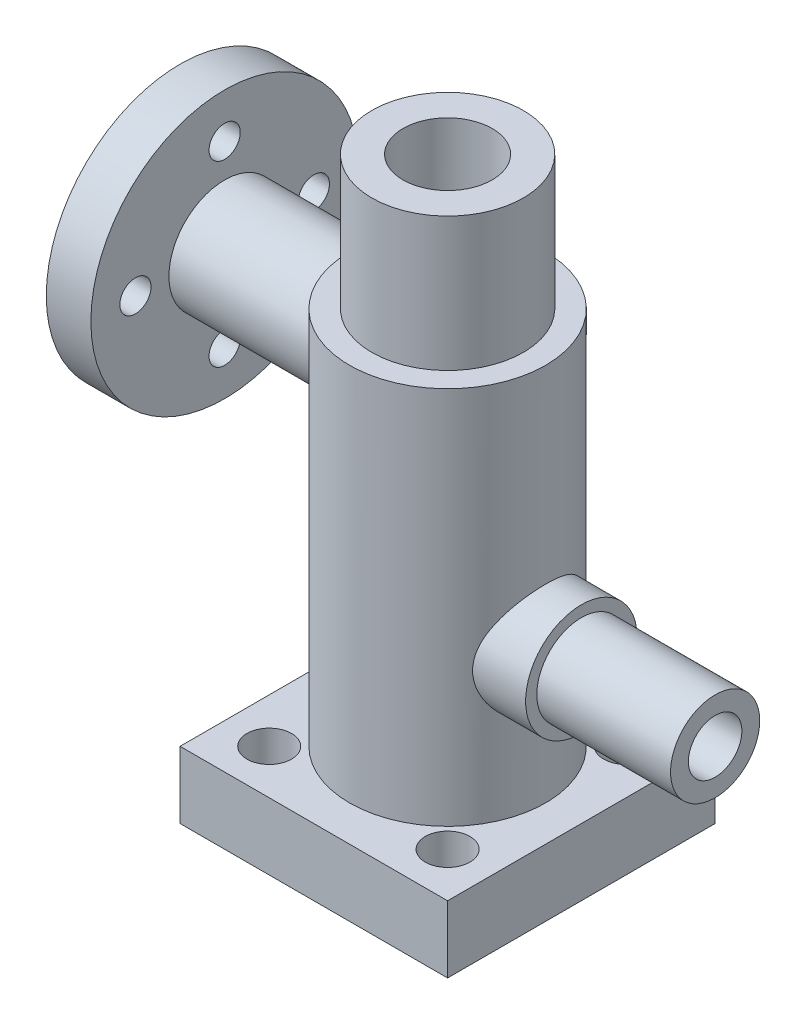
from build123d import *

# Parameters (mm, degrees)
SKETCH1_W                             = 60
SKETCH1_H                             = 60
BOSS_EXTRUDE1_DEPTH                   = 15
SKETCH2_R                             = 22
BOSS_EXTRUDE2_DEPTH                   = 85
SKETCH3_R                             = 17
BOSS_EXTRUDE3_DEPTH                   = 30
HOLE1_D                               = 20
HOLE1_DEPTH                           = 115
SKETCH9_R                             = 5
CUT_EXTRUDE1_DEPTH                    = 123.576506721
MIRROR2_COPY_1_SKETCH_R               = 5
MIRROR2_COPY_1_DEPTH                  = 123.576506721
BOSS_EXTRUDE4_REACH                   = 162.935
BOSS_EXTRUDE4_END_RADIUS              = 22
SKETCH10_R                            = 12.5
SKETCH11_R                            = 30
BOSS_EXTRUDE5_DEPTH                   = 10
HOLE2_REACH                           = 162.935
HOLE2_BORE_R                          = 10
TAP_DRILL_FOR_M8X1_0_TAP1_D           = 7
TAP_DRILL_FOR_M8X1_0_TAP1_DEPTH       = 10
TAP_DRILL_FOR_M8X1_0_TAP1_CSINK_D     = 7.05
TAP_DRILL_FOR_M8X1_0_TAP1_CSINK_ANGLE = 90
CIRPATTERN1_COUNT                     = 4
BOSS_EXTRUDE6_REACH                   = 211.444
BOSS_EXTRUDE6_END_RADIUS              = 22
BOSS_EXTRUDE6_START                   = -30
SKETCH18_R                            = 12.5
SKETCH20_R                            = 10
BOSS_EXTRUDE7_DEPTH                   = 30
HOLE3_REACH                           = 181.444
HOLE3_BORE_R                          = 6


with BuildPart() as part:
    # Sketch1 → Boss-Extrude1 (new body)
    with BuildSketch(Plane(origin=(0, 0, 0), x_dir=(1, 0, 0), z_dir=(0, 1, 0))):
        Rectangle(SKETCH1_W, SKETCH1_H)
    extrude(amount=BOSS_EXTRUDE1_DEPTH)

    # Sketch2 → Boss-Extrude2 (add)
    with BuildSketch(Plane(origin=(0, 15, 0), x_dir=(1, 0, 0), z_dir=(0, 1, 0))):
        with Locations(Location((0, 0, 0), (0, 0, 270))):
            Circle(SKETCH2_R)
    extrude(amount=BOSS_EXTRUDE2_DEPTH)

    # Sketch3 → Boss-Extrude3 (add)
    with BuildSketch(Plane(origin=(0, 100, 0), x_dir=(1, 0, 0), z_dir=(0, 1, 0))):
        with Locations(Location((0, 0, 0), (0, 0, 270))):
            Circle(SKETCH3_R)
    extrude(amount=BOSS_EXTRUDE3_DEPTH)

    # Hole1
    with Locations(Plane(origin=(0, 130, 0), x_dir=(1, 0, 0), z_dir=(0, 1, 0))):
        with Locations((0, 0)):
            Hole(HOLE1_D / 2, depth=HOLE1_DEPTH)

    # Sketch9 → Cut-Extrude1 (cut, through all)
    with BuildSketch(Plane(origin=(0, 15, 0), x_dir=(1, 0, 0), z_dir=(0, 1, 0))):
        with Locations(Location((20, 20, 0), (0, 0, 270))):
            Circle(SKETCH9_R)
    cut_extrude1 = extrude(amount=-CUT_EXTRUDE1_DEPTH, mode=Mode.SUBTRACT)

    # Mirror1: Cut-Extrude1 across plane
    add(cut_extrude1.mirror(Plane(origin=(0, 0, 0), x_dir=(0, 0, 1), z_dir=(1, 0, 0))), mode=Mode.SUBTRACT)

    # Mirror2: Cut-Extrude1 across plane
    add(cut_extrude1.mirror(Plane.XY), mode=Mode.SUBTRACT)

    # Mirror2 copy 1 sketch → Mirror2 copy 1 (cut, through all)
    with BuildSketch(Plane(origin=(0, 15, 0), x_dir=(-1, 0, 0), z_dir=(0, 1, 0))):
        with Locations(Location((20, 20, 0), (0, 0, 270))):
            Circle(MIRROR2_COPY_1_SKETCH_R)
    extrude(amount=-MIRROR2_COPY_1_DEPTH, mode=Mode.SUBTRACT)

    # Boss-Extrude4: up to this cylinder (the profile starts outside it)
    boss_extrude4_end = Plane(origin=(0, 87.5, 0), z_dir=(0, -1, 0)) * Cylinder(BOSS_EXTRUDE4_END_RADIUS, 370.87, mode=Mode.PRIVATE)
    # Sketch10 → Boss-Extrude4 (add, up to the surface)
    with BuildSketch(Plane(origin=(-60, 0, 0), x_dir=(0, 0, -1), z_dir=(1, 0, 0)), mode=Mode.PRIVATE) as boss_extrude4_sk1:
        with Locations(Location((0, 87.5, 0), (0, 0, 90))):
            Circle(SKETCH10_R)
    boss_extrude4_tool1 = extrude(boss_extrude4_sk1.sketch, amount=BOSS_EXTRUDE4_REACH, mode=Mode.PRIVATE) - boss_extrude4_end
    add(boss_extrude4_tool1.solids().sort_by_distance((-60, 87.5, 0))[0])

    # Sketch11 → Boss-Extrude5 (add)
    with BuildSketch(Plane.ZY.offset(60)):
        with Locations((0, 87.5)):
            Circle(SKETCH11_R)
    extrude(amount=-BOSS_EXTRUDE5_DEPTH)

    # Hole2 bore → Hole2 (cut, up to next)
    with BuildSketch(Plane.ZY.offset(60), mode=Mode.PRIVATE) as hole2_sk1:
        with Locations((0, 87.5)):
            Circle(HOLE2_BORE_R)
    hole2_tool1 = extrude(hole2_sk1.sketch, amount=-HOLE2_REACH, mode=Mode.PRIVATE) & part.part
    add(hole2_tool1.solids().sort_by_distance((-60, 87.5, 0))[0], mode=Mode.SUBTRACT)

    # Tap Drill for M8x1.0 Tap1
    with Locations(Plane.ZY.offset(60)):
        with Locations((20, 87.5)):
            tap_drill_for_m8x1_0_tap1 = CounterSinkHole(TAP_DRILL_FOR_M8X1_0_TAP1_D / 2, TAP_DRILL_FOR_M8X1_0_TAP1_CSINK_D / 2, depth=TAP_DRILL_FOR_M8X1_0_TAP1_DEPTH, counter_sink_angle=TAP_DRILL_FOR_M8X1_0_TAP1_CSINK_ANGLE)

    # CirPattern1: Tap Drill for M8x1.0 Tap1 ×4 about axis
    cirpattern1_axis = Axis((0, 87.5, 0), (1, 0, 0))
    for i in range(1, CIRPATTERN1_COUNT):
        add(tap_drill_for_m8x1_0_tap1.rotate(cirpattern1_axis, i * 360 / CIRPATTERN1_COUNT), mode=Mode.SUBTRACT)

    # Boss-Extrude6: up to this cylinder (the profile starts outside it)
    boss_extrude6_end = Plane(origin=(0, 45, 0), z_dir=(0, -1, 0)) * Cylinder(BOSS_EXTRUDE6_END_RADIUS, 467.888, mode=Mode.PRIVATE)
    # Sketch18 → Boss-Extrude6 (add, up to the surface)
    with BuildSketch(Plane(origin=(60, 0, 0), x_dir=(0, 0, -1), z_dir=(1, 0, 0)).offset(BOSS_EXTRUDE6_START), mode=Mode.PRIVATE) as boss_extrude6_sk1:
        with Locations((0, 45)):
            Circle(SKETCH18_R)
    boss_extrude6_tool1 = extrude(boss_extrude6_sk1.sketch, amount=-BOSS_EXTRUDE6_REACH, mode=Mode.PRIVATE) - boss_extrude6_end
    add(boss_extrude6_tool1.solids().sort_by_distance((30, 45, 0))[0])

    # Sketch20 → Boss-Extrude7 (add)
    with BuildSketch(Plane(origin=(30, 0, 0), x_dir=(0, 0, -1), z_dir=(1, 0, 0))):
        with Locations((0, 45)):
            Circle(SKETCH20_R)
    extrude(amount=BOSS_EXTRUDE7_DEPTH)

    # Hole3 bore → Hole3 (cut, up to next)
    with BuildSketch(Plane(origin=(60, 0, 0), x_dir=(0, 0, -1), z_dir=(1, 0, 0)), mode=Mode.PRIVATE) as hole3_sk1:
        with Locations((0, 45)):
            Circle(HOLE3_BORE_R)
    hole3_tool1 = extrude(hole3_sk1.sketch, amount=-HOLE3_REACH, mode=Mode.PRIVATE) & part.part
    add(hole3_tool1.solids().sort_by_distance((60, 45, 0))[0], mode=Mode.SUBTRACT)


solid = part.part
